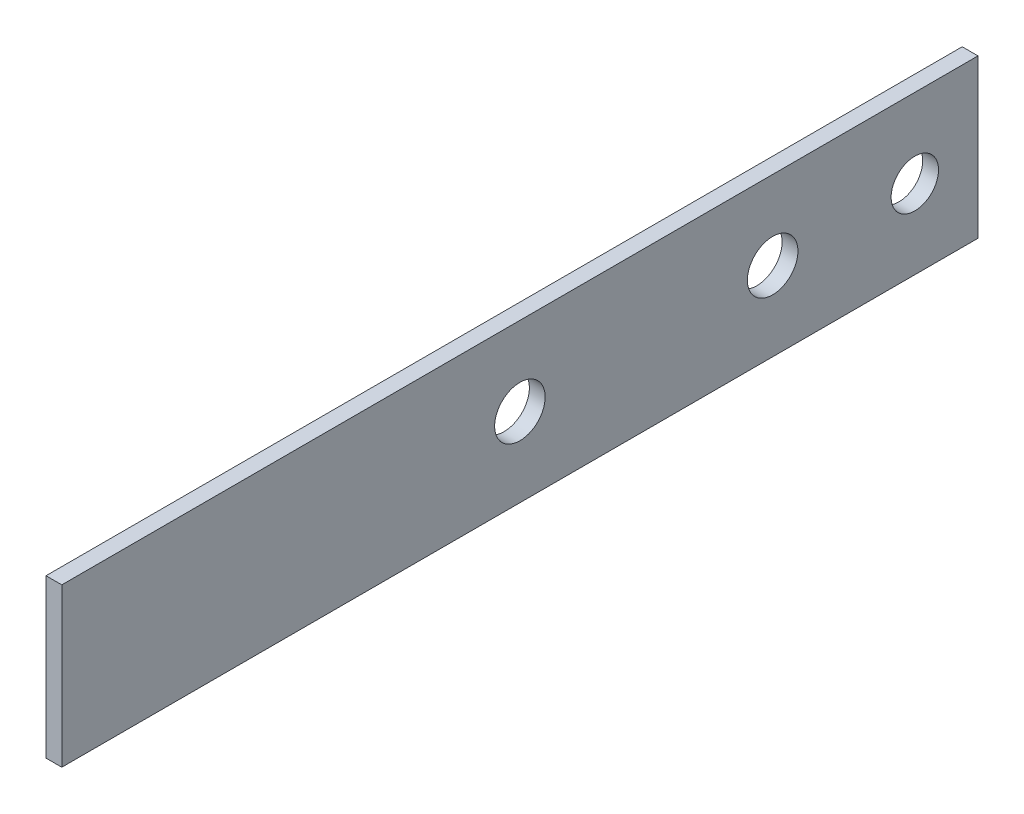
from build123d import *

# Parameters (mm, degrees)
SKETCH_1_W           = 58
SKETCH_1_H           = 10
EXTRUDE_1_DEPTH      = 1
HOLE_WIZARD_M3_1_D   = 3.2
HOLE_WIZARD_M3_1_2_D = 3


with BuildPart() as part:
    # 草图1 → 凸台-拉伸1 (new body)
    with BuildSketch(Plane(origin=(0, 0, 0), x_dir=(0, 0, -1), z_dir=(1, 0, 0))):
        Rectangle(SKETCH_1_W, SKETCH_1_H)
    extrude(amount=EXTRUDE_1_DEPTH)

    # Hole Wizard M3 _1 (through all)
    with Locations(Plane(origin=(1, 0, 0), x_dir=(0, 0, -1), z_dir=(1, 0, 0))):
        with Locations((16, 0), (0, 0)):
            Hole(HOLE_WIZARD_M3_1_D / 2)

    # Hole Wizard M3 _1 2 (through all)
    with Locations(Plane(origin=(1, 0, 0), x_dir=(0, 0, -1), z_dir=(1, 0, 0))):
        with Locations((25, 0)):
            Hole(HOLE_WIZARD_M3_1_2_D / 2)


solid = part.part
